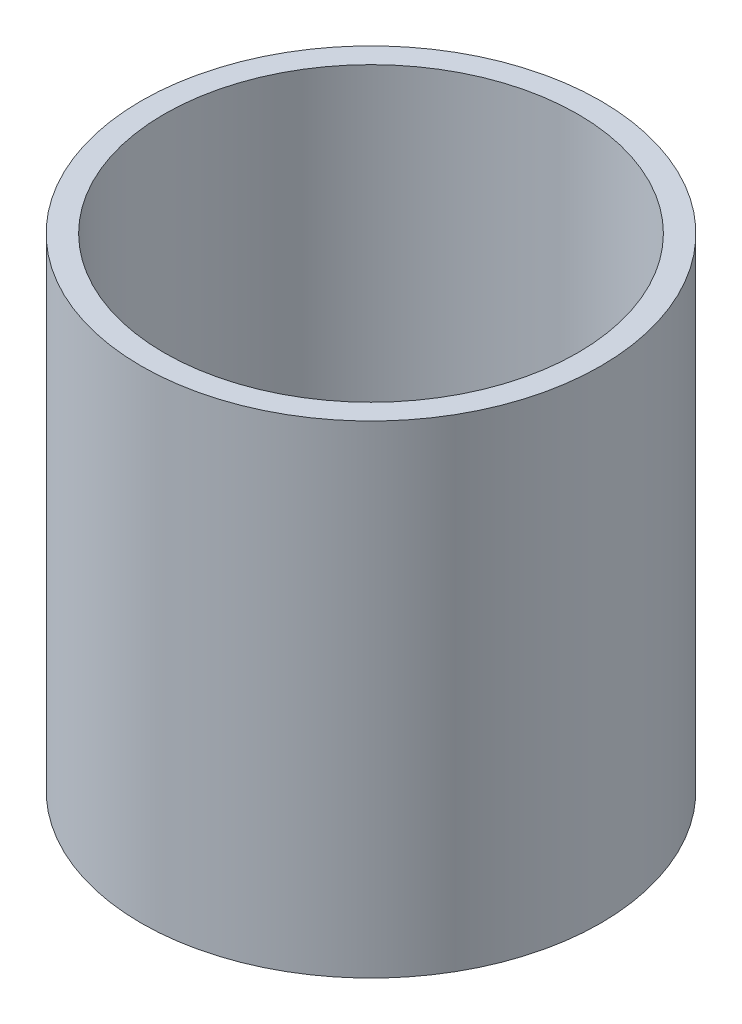
from build123d import *

# Parameters (mm, degrees)
SKETCH_1_R      = 10
SKETCH_1_R_2    = 9
EXTRUDE_1_DEPTH = 21


with BuildPart() as part:
    # 草图1 → 凸台-拉伸1 (new body)
    with BuildSketch(Plane(origin=(0, 0, 0), x_dir=(1, 0, 0), z_dir=(0, 1, 0))):
        with Locations(Location((0, 0, 0), (0, 0, 90))):
            Circle(SKETCH_1_R)
        with Locations(Location((0, 0, 0), (0, 0, 90))):
            Circle(SKETCH_1_R_2, mode=Mode.SUBTRACT)
    extrude(amount=EXTRUDE_1_DEPTH)


solid = part.part
